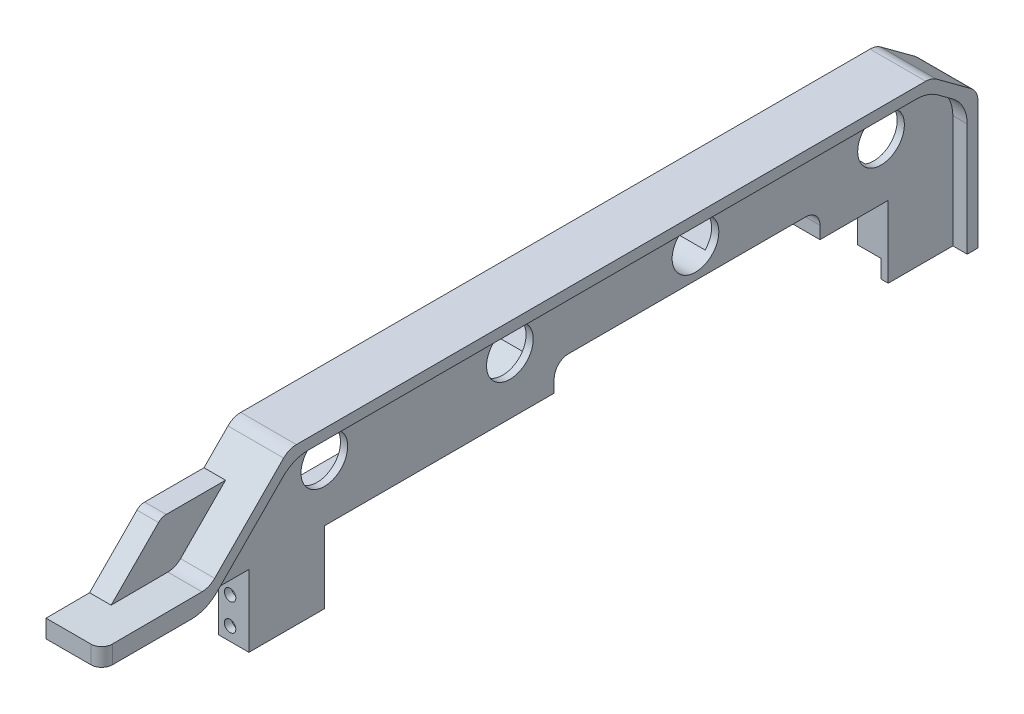
from build123d import *

# Parameters (mm, degrees)
BOSS_EXTRUDE1_DEPTH      = 25
CUT_EXTRUDE1_DEPTH       = 4
FILLET1_R                = 4
FILLET2_R                = 10
FILLET3_R                = 5
FILLET4_R                = 3
BOSS_EXTRUDE2_DEPTH      = 3
BOSS_EXTRUDE2_DEPTH_BACK = 3
FILLET5_R                = 3
SKETCH6_W                = 13
SKETCH6_H                = 14
BOSS_EXTRUDE3_DEPTH      = 20
BOSS_EXTRUDE4_DEPTH      = 20
SKETCH9_W                = 13
SKETCH9_H                = 2
BOSS_EXTRUDE5_DEPTH      = 8
SKETCH7_W                = 13
SKETCH7_H                = 2
CUT_EXTRUDE2_DEPTH       = 5
SKETCH11_R               = 1.6
CUT_EXTRUDE3_DEPTH       = 19
CUT_EXTRUDE4_START       = -2
SKETCH12_R               = 1.6
CUT_EXTRUDE4_DEPTH       = 2
CUT_EXTRUDE5_DEPTH       = 6.5
CUT_EXTRUDE5_DEPTH_BACK  = 6.5
LARGE_START              = -17
SKETCH15_R               = 6.5
LARGE_SCREW_HOLES_DEPTH  = 17
SKETCH17_W               = 9.5
SKETCH17_H               = 262.988655448
CUT_EXTRUDE6_DEPTH       = 141.64583179
SKETCH18_W               = 3
SKETCH18_H               = 20
CUT_EXTRUDE7_DEPTH       = 203.440732067


with BuildPart() as part:
    # Sketch1 → Boss-Extrude1 (new body)
    with BuildSketch(Plane(origin=(0, 0, 0), x_dir=(0, 0, -1), z_dir=(1, 0, 0))):
        Polygon((0, 0), (-130, 0), (-130, 5), (-100.000366453, 5.148280317), (-77.868517379, 27.5), (101.088229162, 27.5), (114, 18), (114, 0), (74, 0), (74, 7.5), (0, 7.5), align=None)
    extrude(amount=BOSS_EXTRUDE1_DEPTH)

    # Sketch4 → Cut-Extrude1 (cut)
    with BuildSketch(Plane(origin=(25, 0, 0), x_dir=(0, 0, -1), z_dir=(1, 0, 0))):
        Polygon((-100.876178749, 0), (0, 0), (111, 0), (111, 3), (111, 16.482758557), (100.103496394, 24.5), (-76.617181678, 24.5), align=None)
    cut_extrude1 = extrude(amount=-CUT_EXTRUDE1_DEPTH, mode=Mode.SUBTRACT)

    # Mirror2: Cut-Extrude1 across plane
    add(cut_extrude1.mirror(Plane(origin=(12.5, 0, 0), x_dir=(0, 0, 1), z_dir=(1, 0, 0))), mode=Mode.SUBTRACT)

    # Fillet1
    fillet1_edges = [part.edges().sort_by_distance(p)[0] for p in [
        (12.5, 7.5, -74),
        (12.5, 7.5, 0),
    ]]
    fillet(fillet1_edges, radius=FILLET1_R)

    # Fillet2
    fillet2_edges = [part.edges().sort_by_distance(p)[0] for p in [
        (23, 0, 100.876178749),
        (23, 24.5, 76.617181678),
        (23, 24.5, -100.103496394),
        (23, 16.482758557, -111),
        (2, 0, 100.876178749),
        (2, 16.482758557, -111),
        (2, 24.5, -100.103496394),
        (2, 24.5, 76.617181678),
    ]]
    fillet(fillet2_edges, radius=FILLET2_R)

    # Fillet3
    fillet3_edges = [part.edges().sort_by_distance(p)[0] for p in [
        (12.5, 5.148280317, 100.000366453),
        (12.5, 27.5, 77.868517379),
        (12.5, 27.5, -101.088229162),
        (12.5, 18, -114),
    ]]
    fillet(fillet3_edges, radius=FILLET3_R)

    # Fillet4
    fillet4_edges = [part.edges().sort_by_distance(p)[0] for p in [
        (0, 2.5, 130),
        (25, 2.5, 130),
    ]]
    fillet(fillet4_edges, radius=FILLET4_R)

    # Sketch5 → Boss-Extrude2 (add, two sides: drawn at the far end of the back side and taken through both)
    with BuildSketch(Plane(origin=(12.5, 0, 0), x_dir=(0, 0, -1), z_dir=(1, 0, 0)).offset(-BOSS_EXTRUDE2_DEPTH_BACK)):
        Polygon((-117.8659777, 5.059975288), (-103.793914836, 19.271838176), (-72.605250228, 19.271838176), (-95.8659777, 5.059975288), align=None)
    extrude(amount=BOSS_EXTRUDE2_DEPTH + BOSS_EXTRUDE2_DEPTH_BACK)

    # Fillet5
    fillet5_edges = [part.edges().sort_by_distance(p)[0] for p in [
        (12.5, 19.271838176, 103.793914836),
    ]]
    fillet(fillet5_edges, radius=FILLET5_R)

    # Sketch6 → Boss-Extrude3 (add)
    with BuildSketch(Plane.XZ):
        Polygon((0, -111), (4, -111), (4, -93), (21, -93), (21, -111), (25, -111), (25, -114), (0, -114), align=None)
        with Locations((12.5, -102)):
            Rectangle(SKETCH6_W, SKETCH6_H, mode=Mode.SUBTRACT)
    extrude(amount=BOSS_EXTRUDE3_DEPTH)

    # Sketch8 → Boss-Extrude4 (add)
    with BuildSketch(Plane.XZ):
        Polygon((21, 85), (4, 85), (4, 64), (6, 64), (6, 83), (19, 83), (19, 64), (21, 64), align=None)
    extrude(amount=BOSS_EXTRUDE4_DEPTH)

    # Sketch9 → Boss-Extrude5 (add)
    with BuildSketch(Plane.XZ):
        with Locations((12.5, 65)):
            Rectangle(SKETCH9_W, SKETCH9_H)
    extrude(amount=BOSS_EXTRUDE5_DEPTH)

    # Sketch7 → Cut-Extrude2 (cut)
    with BuildSketch(Plane.XZ.offset(20)):
        with Locations((12.5, -94)):
            Rectangle(SKETCH7_W, SKETCH7_H)
    extrude(amount=-CUT_EXTRUDE2_DEPTH, mode=Mode.SUBTRACT)

    # Sketch11 → Cut-Extrude3 (cut)
    with BuildSketch(Plane(origin=(0, 0, -114), x_dir=(-1, 0, 0), z_dir=(0, 0, -1))):
        with Locations((-15.75, -16.25)):
            Circle(SKETCH11_R)
        with Locations((-15.75, -8.75)):
            Circle(SKETCH11_R)
        with Locations((-9.25, -8.75)):
            Circle(SKETCH11_R)
        with Locations((-9.25, -16.25)):
            Circle(SKETCH11_R)
    extrude(amount=-CUT_EXTRUDE3_DEPTH, mode=Mode.SUBTRACT)

    # Sketch12 → Cut-Extrude4 (cut)
    with BuildSketch(Plane.XY.offset(85).offset(CUT_EXTRUDE4_START)):
        with Locations(Location((15.75, -16.25, 0), (0, 0, 180))):
            Circle(SKETCH12_R)
        with Locations(Location((9.25, -16.25, 0), (0, 0, 180))):
            Circle(SKETCH12_R)
        with Locations(Location((9.25, -8.75, 0), (0, 0, 180))):
            Circle(SKETCH12_R)
        with Locations(Location((15.75, -8.75, 0), (0, 0, 180))):
            Circle(SKETCH12_R)
    extrude(amount=CUT_EXTRUDE4_DEPTH, mode=Mode.SUBTRACT)

    # Sketch14 → Cut-Extrude5 (cut, two sides: drawn at the far end of the back side and taken through both)
    with BuildSketch(Plane(origin=(12.5, 0, 0), x_dir=(0, 0, -1), z_dir=(1, 0, 0)).offset(-CUT_EXTRUDE5_DEPTH_BACK)):
        Polygon((-83, 0), (-83, 13.475167258), (-72.975167258, 23.5), (95.592427597, 23.5), (109, 10.092427597), (109, 0), (95, 0), (95, 3.57939317), (87.07939317, 11.5), (-5.825100808, 11.5), (-13.325100808, 4), (-66, 4), (-66, 0), align=None)
    extrude(amount=CUT_EXTRUDE5_DEPTH + CUT_EXTRUDE5_DEPTH_BACK, mode=Mode.SUBTRACT)

    # Sketch15 → large screw holes (cut)
    with BuildSketch(Plane.ZY.offset(-4).offset(LARGE_START)):
        with Locations((-91, 16)):
            Circle(SKETCH15_R)
        with Locations((-39.333333333, 16)):
            Circle(SKETCH15_R)
        with Locations((64, 16)):
            Circle(SKETCH15_R)
        with Locations((12.333333333, 16)):
            Circle(SKETCH15_R)
    extrude(amount=LARGE_SCREW_HOLES_DEPTH, mode=Mode.SUBTRACT)

    # Sketch17 → Cut-Extrude6 (cut, through all)
    with BuildSketch(Plane(origin=(0, 27.5, 0), x_dir=(1, 0, 0), z_dir=(0, 1, 0))):
        with Locations((4.75, -2.000036068)):
            Rectangle(SKETCH17_W, SKETCH17_H)
    extrude(amount=-CUT_EXTRUDE6_DEPTH, mode=Mode.SUBTRACT)

    # Sketch18 → Cut-Extrude7 (cut, through all)
    with BuildSketch(Plane.XY.offset(85)):
        with Locations((11, -10)):
            Rectangle(SKETCH18_W, SKETCH18_H)
    extrude(amount=-CUT_EXTRUDE7_DEPTH, mode=Mode.SUBTRACT)


solid = part.part
